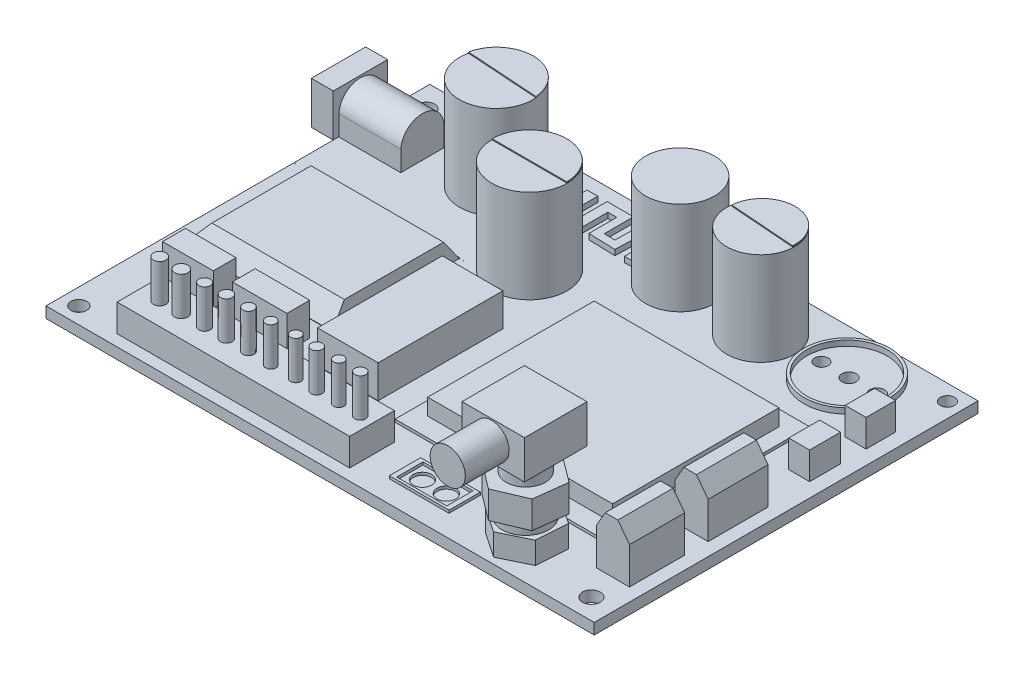
from build123d import *

# Parameters (mm, degrees)
SKETCH1_W            = 100
SKETCH1_H            = 70
BOSS_EXTRUDE2_DEPTH  = 2
SKETCH2_R            = 1.51253395
CUT_EXTRUDE3_DEPTH   = 3
SKETCH3_R            = 1.435290784
CUT_EXTRUDE4_DEPTH   = 3
SKETCH4_R            = 1.301317422
CUT_EXTRUDE5_DEPTH   = 3
SKETCH5_R            = 1.616299526
CUT_EXTRUDE6_DEPTH   = 3
SKETCH6_W            = 17.296093804
SKETCH6_H            = 7.856677749
BOSS_EXTRUDE3_DEPTH  = 7.5
CUT_EXTRUDE14_DEPTH  = 19
CUT_EXTRUDE15_DEPTH  = 19
SKETCH15_W           = 9.915871842
SKETCH15_H           = 7.754440815
BOSS_EXTRUDE6_DEPTH  = 4
SKETCH16_R           = 2.634959219
CUT_EXTRUDE16_DEPTH  = 7
SKETCH17_R           = 0.632651109
BOSS_EXTRUDE7_DEPTH  = 7
SKETCH18_W           = 38.944699871
SKETCH18_H           = 36.600864012
BOSS_EXTRUDE8_DEPTH  = 0.5
SKETCH19_W           = 33.712674361
SKETCH19_H           = 30.360976244
BOSS_EXTRUDE9_DEPTH  = 3
SKETCH20_R           = 4.233704758
BOSS_EXTRUDE10_DEPTH = 6
BOSS_EXTRUDE11_DEPTH = 4
BOSS_EXTRUDE12_DEPTH = 5
SKETCH23_R           = 3.565387507
BOSS_EXTRUDE13_DEPTH = 4
SKETCH25_W           = 11.404419794
SKETCH25_H           = 11.382842663
BOSS_EXTRUDE15_DEPTH = 7
SKETCH26_R           = 6.689801097
BOSS_EXTRUDE16_DEPTH = 17
SKETCH27_R           = 6.866565466
BOSS_EXTRUDE17_DEPTH = 17
SKETCH28_R           = 6.301055495
BOSS_EXTRUDE18_DEPTH = 17
SKETCH29_R           = 7.819319871
SKETCH29_R_2         = 7.331015426
BOSS_EXTRUDE19_DEPTH = 1
SKETCH30_R           = 1.224837422
SKETCH30_R_2         = 1.295697706
SKETCH30_R_3         = 1.363169535
CUT_EXTRUDE17_DEPTH  = 4
SKETCH31_R           = 6.196218195
BOSS_EXTRUDE20_DEPTH = 17
BOSS_EXTRUDE21_DEPTH = 1
SKETCH33_W           = 6.064004915
SKETCH33_H           = 10.063918005
SKETCH33_H_2         = 10.926328033
BOSS_EXTRUDE22_DEPTH = 12
CUT_EXTRUDE18_DEPTH  = 30
SKETCH35_R           = 3.204762314
BOSS_EXTRUDE23_DEPTH = 8
BOSS_EXTRUDE24_DEPTH = 0.2
BOSS_EXTRUDE26_DEPTH = 0.2
SKETCH39_W           = 42.420593117
SKETCH39_H           = 8.139528328
BOSS_EXTRUDE28_DEPTH = 5
SKETCH40_R           = 1.148031819
SKETCH40_R_2         = 1.203752985
SKETCH40_R_3         = 1.031903615
SKETCH40_R_4         = 1.064309385
SKETCH40_R_5         = 1.004854584
SKETCH40_R_6         = 0.948873446
SKETCH40_R_7         = 0.953551092
SKETCH40_R_8         = 1.00350664
SKETCH40_R_9         = 0.936196688
SKETCH40_R_10        = 0.993975384
BOSS_EXTRUDE29_DEPTH = 7
SKETCH41_W           = 10.880281735
SKETCH41_H           = 5.705391715
SKETCH41_W_2         = 9.133960923
SKETCH41_H_2         = 4.789657679
BOSS_EXTRUDE30_DEPTH = 0.5
SKETCH42_R           = 1.691616723
SKETCH42_R_2         = 1.697538339
CUT_EXTRUDE19_DEPTH  = 0.5
SKETCH43_W           = 11.047019053
SKETCH43_H           = 22.747429694
BOSS_EXTRUDE31_DEPTH = 6
SKETCH44_W           = 27.456176691
SKETCH44_H           = 23.220217749
BOSS_EXTRUDE32_DEPTH = 4
SKETCH45_W           = 3.808850914
SKETCH45_H           = 5.638392459
SKETCH45_H_2         = 5.360307876
BOSS_EXTRUDE33_DEPTH = 5
BOSS_EXTRUDE34_DEPTH = 0.2
CUT_EXTRUDE20_DEPTH  = 25
CUT_EXTRUDE21_DEPTH  = 31
CUT_EXTRUDE23_DEPTH  = 31
SKETCH51_W           = 9.249811189
SKETCH51_H           = 4.161832761
SKETCH51_W_2         = 9.952986002
BOSS_EXTRUDE35_DEPTH = 6


with BuildPart() as part:
    # Sketch1 → Boss-Extrude2 (new body)
    with BuildSketch(Plane(origin=(0, 0, 0), x_dir=(1, 0, 0), z_dir=(0, 1, 0))):
        Rectangle(SKETCH1_W, SKETCH1_H)
    extrude(amount=BOSS_EXTRUDE2_DEPTH)

    # Sketch2 → Cut-Extrude3 (cut)
    with BuildSketch(Plane(origin=(0, 2, 0), x_dir=(1, 0, 0), z_dir=(0, 1, 0))):
        with Locations((-46.439620532, 30.814260712)):
            Circle(SKETCH2_R)
    extrude(amount=-CUT_EXTRUDE3_DEPTH, mode=Mode.SUBTRACT)

    # Sketch3 → Cut-Extrude4 (cut)
    with BuildSketch(Plane(origin=(0, 2, 0), x_dir=(1, 0, 0), z_dir=(0, 1, 0))):
        with Locations((-47.004076073, -32.008947101)):
            Circle(SKETCH3_R)
    extrude(amount=-CUT_EXTRUDE4_DEPTH, mode=Mode.SUBTRACT)

    # Sketch4 → Cut-Extrude5 (cut)
    with BuildSketch(Plane(origin=(0, 2, 0), x_dir=(1, 0, 0), z_dir=(0, 1, 0))):
        with Locations((47.302855544, 32.117059369)):
            Circle(SKETCH4_R)
    extrude(amount=-CUT_EXTRUDE5_DEPTH, mode=Mode.SUBTRACT)

    # Sketch5 → Cut-Extrude6 (cut)
    with BuildSketch(Plane(origin=(0, 2, 0), x_dir=(1, 0, 0), z_dir=(0, 1, 0))):
        with Locations((45.747085663, -31.267682523)):
            Circle(SKETCH5_R)
    extrude(amount=-CUT_EXTRUDE6_DEPTH, mode=Mode.SUBTRACT)

    # Sketch6 → Boss-Extrude3 (add)
    with BuildSketch(Plane(origin=(0, 2, 0), x_dir=(1, 0, 0), z_dir=(0, 1, 0))):
        with Locations((-47.333268099, 22.322741547)):
            Rectangle(SKETCH6_W, SKETCH6_H)
    extrude(amount=BOSS_EXTRUDE3_DEPTH)

    # Sketch13 → Cut-Extrude14 (cut)
    with BuildSketch(Plane.ZY.offset(55.981315001)):
        with BuildLine():
            Line((-18.394402672, 9.5), (-26.251080421, 9.5))
            Line((-26.251080421, 9.5), (-26.251080421, 5.951221756))
            ThreePointArc((-26.251080421, 5.951221756), (-22.211334605, 9.370260294), (-18.394402672, 5.704144993))
            Line((-18.394402672, 5.704144993), (-18.394402672, 9.5))
        make_face()
    extrude(amount=-CUT_EXTRUDE14_DEPTH, mode=Mode.SUBTRACT)

    # Sketch14 → Cut-Extrude15 (cut)
    with BuildSketch(Plane(origin=(0, 2, 0), x_dir=(-1, 0, 0), z_dir=(0, -1, 0))):
        Polygon((49.983450697, 17.629135674), (49.983450697, 26.82990783), (57.169456537, 26.82990783), (57.911353863, 13.473102082), align=None)
    extrude(amount=-CUT_EXTRUDE15_DEPTH, mode=Mode.SUBTRACT)

    # Sketch15 → Boss-Extrude6 (add)
    with BuildSketch(Plane.ZY.offset(49.983450697)):
        with Locations((-22.336364996, 5.892577674)):
            Rectangle(SKETCH15_W, SKETCH15_H)
    extrude(amount=BOSS_EXTRUDE6_DEPTH)

    # Sketch16 → Cut-Extrude16 (cut)
    with BuildSketch(Plane.ZY.offset(53.983450697)):
        with Locations((-22.358887933, 5.764755063)):
            Circle(SKETCH16_R)
    extrude(amount=-CUT_EXTRUDE16_DEPTH, mode=Mode.SUBTRACT)

    # Sketch17 → Boss-Extrude7 (add)
    with BuildSketch(Plane.ZY.offset(46.983450697)):
        with Locations((-22.320088974, 5.946166612)):
            Circle(SKETCH17_R)
    extrude(amount=BOSS_EXTRUDE7_DEPTH)

    # Sketch18 → Boss-Extrude8 (add)
    with BuildSketch(Plane(origin=(0, 2, 0), x_dir=(1, 0, 0), z_dir=(0, 1, 0))):
        with Locations((19.693389893, -3.245226769)):
            Rectangle(SKETCH18_W, SKETCH18_H)
    extrude(amount=BOSS_EXTRUDE8_DEPTH)

    # Sketch19 → Boss-Extrude9 (add)
    with BuildSketch(Plane(origin=(0, 2.5, 0), x_dir=(1, 0, 0), z_dir=(0, 1, 0))):
        with Locations((19.582517613, -2.921097191)):
            Rectangle(SKETCH19_W, SKETCH19_H)
    extrude(amount=BOSS_EXTRUDE9_DEPTH)

    # Sketch20 → Boss-Extrude10 (add)
    with BuildSketch(Plane(origin=(0, 2, 0), x_dir=(1, 0, 0), z_dir=(0, 1, 0))):
        with Locations((30.998863529, -28.543635421)):
            Circle(SKETCH20_R)
    extrude(amount=BOSS_EXTRUDE10_DEPTH)

    # Sketch21 → Boss-Extrude11 (add)
    with BuildSketch(Plane(origin=(0, 2, 0), x_dir=(1, 0, 0), z_dir=(0, 1, 0))):
        Polygon((35.633474842, -31.385140334), (36.038927392, -25.711295185), (31.327959631, -22.523240403), (26.21153932, -25.009030769), (25.80608677, -30.682875917), (30.517054531, -33.8709307), align=None)
    extrude(amount=BOSS_EXTRUDE11_DEPTH)

    # Sketch22 → Boss-Extrude12 (add)
    with BuildSketch(Plane(origin=(0, 8, 0), x_dir=(1, 0, 0), z_dir=(0, 1, 0))):
        Polygon((30.268549477, -34.55496132), (35.839667442, -32.181768892), (36.569981494, -26.170442993), (31.729177581, -22.532309522), (26.158059616, -24.905501949), (25.427745564, -30.916827849), align=None)
    extrude(amount=BOSS_EXTRUDE12_DEPTH)

    # Sketch23 → Boss-Extrude13 (add)
    with BuildSketch(Plane(origin=(0, 13, 0), x_dir=(1, 0, 0), z_dir=(0, 1, 0))):
        with Locations((30.848489906, -28.342205462)):
            Circle(SKETCH23_R)
    extrude(amount=BOSS_EXTRUDE13_DEPTH)

    # Sketch25 → Boss-Extrude15 (add)
    with BuildSketch(Plane(origin=(0, 17, 0), x_dir=(1, 0, 0), z_dir=(0, 1, 0))):
        with Locations((30.764975849, -28.484323116)):
            Rectangle(SKETCH25_W, SKETCH25_H)
    extrude(amount=BOSS_EXTRUDE15_DEPTH)

    # Sketch26 → Boss-Extrude16 (add)
    with BuildSketch(Plane(origin=(0, 2, 0), x_dir=(1, 0, 0), z_dir=(0, 1, 0))):
        with Locations((-27.857496523, 24.980277179)):
            Circle(SKETCH26_R)
    extrude(amount=BOSS_EXTRUDE16_DEPTH)

    # Sketch27 → Boss-Extrude17 (add)
    with BuildSketch(Plane(origin=(0, 2, 0), x_dir=(1, 0, 0), z_dir=(0, 1, 0))):
        with Locations((-11.709117583, 14.899194637)):
            Circle(SKETCH27_R)
    extrude(amount=BOSS_EXTRUDE17_DEPTH)

    # Sketch28 → Boss-Extrude18 (add)
    with BuildSketch(Plane(origin=(0, 2, 0), x_dir=(1, 0, 0), z_dir=(0, 1, 0))):
        with Locations((4.315947941, 26.346942457)):
            Circle(SKETCH28_R)
    extrude(amount=BOSS_EXTRUDE18_DEPTH)

    # Sketch29 → Boss-Extrude19 (add)
    with BuildSketch(Plane(origin=(0, 2, 0), x_dir=(1, 0, 0), z_dir=(0, 1, 0))):
        with Locations((34.618240662, 26.47794403)):
            Circle(SKETCH29_R)
        with Locations((34.618240662, 26.47794403)):
            Circle(SKETCH29_R_2, mode=Mode.SUBTRACT)
    extrude(amount=BOSS_EXTRUDE19_DEPTH)

    # Sketch30 → Cut-Extrude17 (cut)
    with BuildSketch(Plane(origin=(0, 2, 0), x_dir=(1, 0, 0), z_dir=(0, 1, 0))):
        with Locations((29.55477134, 26.885519968)):
            Circle(SKETCH30_R)
        with Locations((34.602259082, 26.885519968)):
            Circle(SKETCH30_R_2)
        with Locations((39.722885751, 26.885519968)):
            Circle(SKETCH30_R_3)
    extrude(amount=-CUT_EXTRUDE17_DEPTH, mode=Mode.SUBTRACT)

    # Sketch31 → Boss-Extrude20 (add)
    with BuildSketch(Plane(origin=(0, 2, 0), x_dir=(1, 0, 0), z_dir=(0, 1, 0))):
        with Locations((19.725889707, 25.626885936)):
            Circle(SKETCH31_R)
    extrude(amount=BOSS_EXTRUDE20_DEPTH)

    # Sketch32 → Boss-Extrude21 (add)
    with BuildSketch(Plane(origin=(0, 2, 0), x_dir=(1, 0, 0), z_dir=(0, 1, 0))):
        Polygon((-4.067589853, 30.214797696), (-5.879567694, 30.268010974), (-6.039899225, 24.808524343), (-10.937367922, 24.952350806), (-10.937367922, 30.040336174), (-12.557149343, 30.040336174), (-12.557149343, 25.013814473), (-14.307271188, 25.013814473), (-17.957780517, 25.013814473), (-17.957780517, 31.654917118), (-16.01007069, 31.654917118), (-16.01007069, 26.648293293), (-14.307271188, 26.648293293), (-14.307271188, 31.654917118), (-9.485607093, 31.654917118), (-9.485607093, 26.311006423), (-7.51995271, 26.275399916), (-7.427170619, 31.397427759), (-4.765788264, 31.349218607), (-2.708035472, 31.349218607), (-2.708035472, 24.596700426), (-4.067589853, 24.596700426), align=None)
    extrude(amount=BOSS_EXTRUDE21_DEPTH)

    # Sketch33 → Boss-Extrude22 (add)
    with BuildSketch(Plane(origin=(0, 2, 0), x_dir=(1, 0, 0), z_dir=(0, 1, 0))):
        with Locations((44.589957957, -21.156390765)):
            Rectangle(SKETCH33_W, SKETCH33_H)
        with Locations((44.589957957, -6.385967335)):
            Rectangle(SKETCH33_W, SKETCH33_H_2)
    extrude(amount=BOSS_EXTRUDE22_DEPTH)

    # Sketch34 → Cut-Extrude18 (cut)
    with BuildSketch(Plane(origin=(0, 0, 0.922803318), x_dir=(-1, 0, 0), z_dir=(0, 0, -1))):
        Polygon((-45.494122156, 11.517685157), (-43.199376839, 11.517685157), (-41.557955499, 8.68588319), (-39.776196559, 17.315728178), (-50.171964981, 17.315728178), (-47.621960414, 8.68588319), align=None)
    extrude(amount=-CUT_EXTRUDE18_DEPTH, mode=Mode.SUBTRACT)

    # Sketch35 → Boss-Extrude23 (add)
    with BuildSketch(Plane.XY.offset(34.175744447)):
        with Locations((30.453939512, 20.541907308)):
            Circle(SKETCH35_R)
    extrude(amount=BOSS_EXTRUDE23_DEPTH)

    # Sketch36 → Boss-Extrude24 (add)
    with BuildSketch(Plane(origin=(0, 19, 0), x_dir=(1, 0, 0), z_dir=(0, 1, 0))):
        with BuildLine():
            Line((-4.914236017, 14.899194637), (-18.50399915, 14.899194637))
            ThreePointArc((-18.50399915, 14.899194637), (-11.709117583, 21.694076204), (-4.914236017, 14.899194637))
        make_face()
    extrude(amount=BOSS_EXTRUDE24_DEPTH)

    # Sketch37 → Boss-Extrude26 (add)
    with BuildSketch(Plane(origin=(0, 19, 0), x_dir=(1, 0, 0), z_dir=(0, 1, 0))):
        with BuildLine():
            Line((-34.385091197, 26.444499322), (-21.193234394, 25.564271184))
            ThreePointArc((-21.193234394, 25.564271184), (-27.408508548, 31.709197577), (-34.385091197, 26.444499322))
        make_face()
    extrude(amount=BOSS_EXTRUDE26_DEPTH)

    # Sketch39 → Boss-Extrude28 (add)
    with BuildSketch(Plane(origin=(0, 2, 0), x_dir=(1, 0, 0), z_dir=(0, 1, 0))):
        with Locations((-17.90872739, -28.835632119)):
            Rectangle(SKETCH39_W, SKETCH39_H)
    extrude(amount=BOSS_EXTRUDE28_DEPTH)

    # Sketch40 → Boss-Extrude29 (add)
    with BuildSketch(Plane(origin=(0, 7, 0), x_dir=(1, 0, 0), z_dir=(0, 1, 0))):
        with Locations((-35.437346921, -28.820662728)):
            Circle(SKETCH40_R)
        with Locations((-31.501537791, -28.820662728)):
            Circle(SKETCH40_R_2)
        with Locations((-27.248794484, -28.820662728)):
            Circle(SKETCH40_R_3)
        with Locations((-23.3932149, -28.687483271)):
            Circle(SKETCH40_R_4)
        with Locations((-19.376821209, -28.687483271)):
            Circle(SKETCH40_R_5)
        with Locations((-15.180910094, -28.820662728)):
            Circle(SKETCH40_R_6)
        with Locations((-10.748403817, -28.687483271)):
            Circle(SKETCH40_R_7)
        with Locations((-6.939011563, -28.687483271)):
            Circle(SKETCH40_R_8)
        with Locations((-2.900831965, -28.687483271)):
            Circle(SKETCH40_R_9)
        with Locations((1.025065687, -28.687483271)):
            Circle(SKETCH40_R_10)
    extrude(amount=BOSS_EXTRUDE29_DEPTH)

    # Sketch41 → Boss-Extrude30 (add)
    with BuildSketch(Plane(origin=(0, 2, 0), x_dir=(1, 0, 0), z_dir=(0, 1, 0))):
        with Locations((14.082848059, -28.150879057)):
            Rectangle(SKETCH41_W, SKETCH41_H)
        with Locations((14.082848058, -28.150879057)):
            Rectangle(SKETCH41_W_2, SKETCH41_H_2, mode=Mode.SUBTRACT)
    extrude(amount=BOSS_EXTRUDE30_DEPTH)

    # Sketch42 → Cut-Extrude19 (cut)
    with BuildSketch(Plane(origin=(0, 2, 0), x_dir=(1, 0, 0), z_dir=(0, 1, 0))):
        with Locations((11.798996731, -28.140457596)):
            Circle(SKETCH42_R)
        with Locations((16.161268043, -28.140457596)):
            Circle(SKETCH42_R_2)
    extrude(amount=-CUT_EXTRUDE19_DEPTH, mode=Mode.SUBTRACT)

    # Sketch43 → Boss-Extrude31 (add)
    with BuildSketch(Plane(origin=(0, 2, 0), x_dir=(1, 0, 0), z_dir=(0, 1, 0))):
        with Locations((-10.242967617, -8.322883368)):
            Rectangle(SKETCH43_W, SKETCH43_H)
    extrude(amount=BOSS_EXTRUDE31_DEPTH)

    # Sketch44 → Boss-Extrude32 (add)
    with BuildSketch(Plane(origin=(0, 2, 0), x_dir=(1, 0, 0), z_dir=(0, 1, 0))):
        with Locations((-33.524204197, -1.373003872)):
            Rectangle(SKETCH44_W, SKETCH44_H)
    extrude(amount=BOSS_EXTRUDE32_DEPTH)

    # Sketch45 → Boss-Extrude33 (add)
    with BuildSketch(Plane(origin=(0, 2, 0), x_dir=(1, 0, 0), z_dir=(0, 1, 0))):
        with Locations((45.503241289, 9.698108316)):
            Rectangle(SKETCH45_W, SKETCH45_H)
        with Locations((45.503241289, 19.859953731)):
            Rectangle(SKETCH45_W, SKETCH45_H_2)
    extrude(amount=BOSS_EXTRUDE33_DEPTH)

    # Sketch46 → Boss-Extrude34 (add)
    with BuildSketch(Plane(origin=(0, 19, 0), x_dir=(1, 0, 0), z_dir=(0, 1, 0))):
        with BuildLine():
            Line((13.802655367, 26.285720031), (25.783206365, 25.391051342))
            ThreePointArc((25.783206365, 25.391051342), (20.240265211, 31.828661185), (13.802655367, 26.285720031))
        make_face()
    extrude(amount=BOSS_EXTRUDE34_DEPTH)

    # Sketch47 → Cut-Extrude20 (cut)
    with BuildSketch(Plane.XY.offset(12.983112746)):
        Polygon((-47.252292542, 2), (-43.964046609, 6), (-47.252292542, 7.175849093), (-48.252782596, 4.827332675), align=None)
    extrude(amount=-CUT_EXTRUDE20_DEPTH, mode=Mode.SUBTRACT)

    # Sketch48 → Cut-Extrude21 (cut)
    with BuildSketch(Plane.ZY.offset(50)):
        Polygon((13.024813397, 2), (7.8821421, 11.13692887), (17.451039703, 11.13692887), align=None)
    extrude(amount=-CUT_EXTRUDE21_DEPTH, mode=Mode.SUBTRACT)

    # Sketch49 → Cut-Extrude23 (cut)
    with BuildSketch(Plane.ZY.offset(50)):
        Polygon((-10.183979381, 1.994730547), (-5.783211345, 8.139716596), (-13.286937438, 7.620481367), align=None)
    extrude(amount=-CUT_EXTRUDE23_DEPTH, mode=Mode.SUBTRACT)

    # Sketch51 → Boss-Extrude35 (add)
    with BuildSketch(Plane(origin=(0, 2, 0), x_dir=(1, 0, 0), z_dir=(0, 1, 0))):
        with Locations((-38.902706111, -18.129185402)):
            Rectangle(SKETCH51_W, SKETCH51_H)
        with Locations((-25.826080912, -18.129185402)):
            Rectangle(SKETCH51_W_2, SKETCH51_H)
    extrude(amount=BOSS_EXTRUDE35_DEPTH)


solid = part.part
